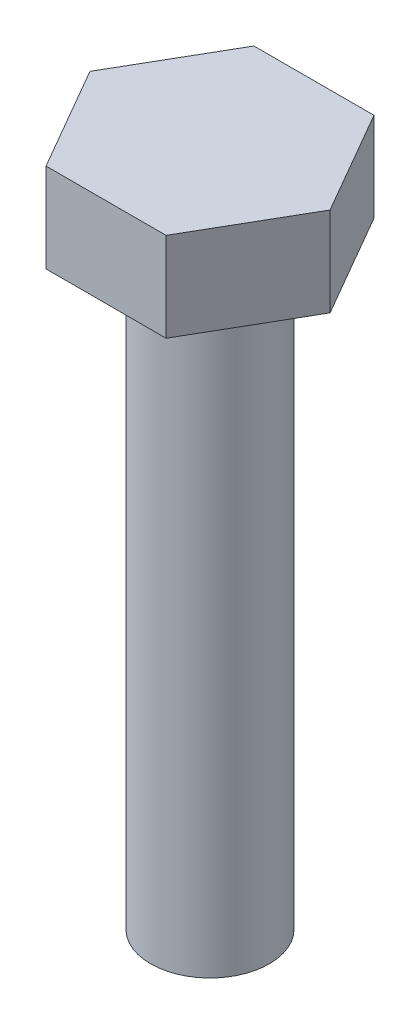
from build123d import *

# Parameters (mm, degrees)
SKETCH1_R           = 2
BOSS_EXTRUDE1_DEPTH = 20
BOSS_EXTRUDE2_DEPTH = 3


with BuildPart() as part:
    # Sketch1 → Boss-Extrude1 (new body)
    with BuildSketch(Plane(origin=(0, 0, 0), x_dir=(1, 0, 0), z_dir=(0, 1, 0))):
        with Locations(Location((0, 0, 0), (0, 0, 270))):
            Circle(SKETCH1_R)
    extrude(amount=BOSS_EXTRUDE1_DEPTH)

    # Sketch2 → Boss-Extrude2 (add)
    with BuildSketch(Plane(origin=(0, 20, 0), x_dir=(1, 0, 0), z_dir=(0, 1, 0))):
        Polygon((4.041451884, 0), (2.020725942, 3.5), (-2.020725942, 3.5), (-4.041451884, 0), (-2.020725942, -3.5), (2.020725942, -3.5), align=None)
    extrude(amount=BOSS_EXTRUDE2_DEPTH)


solid = part.part
